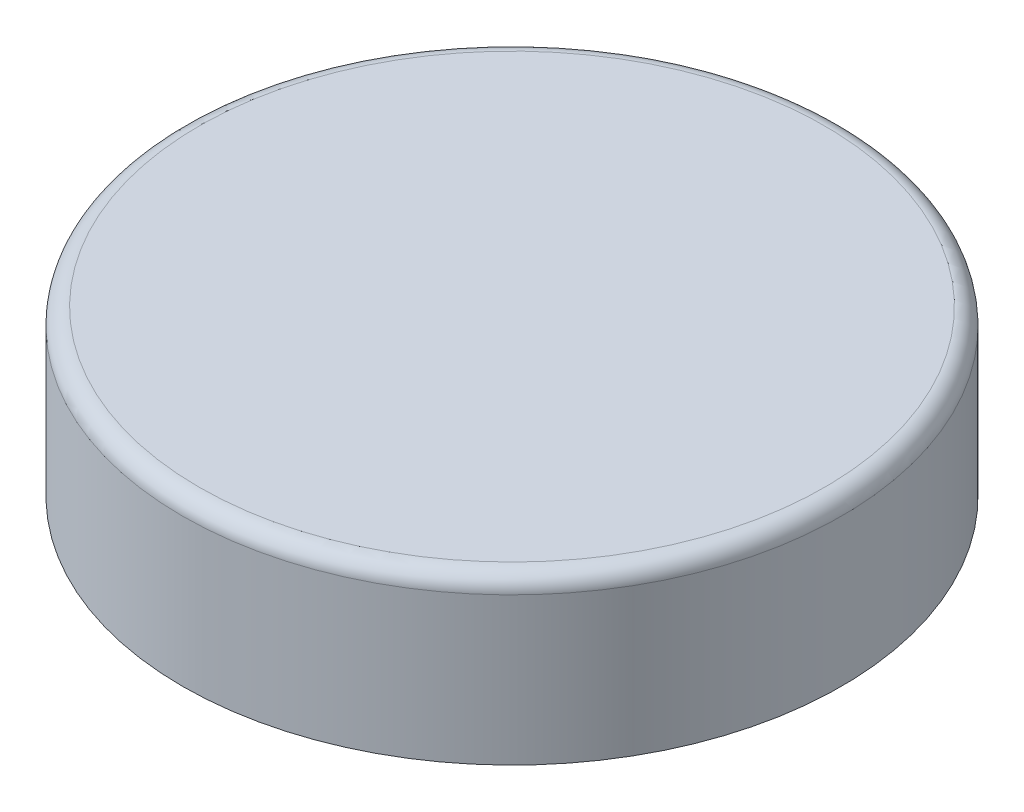
from build123d import *

# Parameters (mm, degrees)
SKETCH1_R           = 5.925
SKETCH1_R_2         = 4.625
BOSS_EXTRUDE1_DEPTH = 2.95
BOSS_EXTRUDE2_START = -0.4
SKETCH2_R           = 5.925
BOSS_EXTRUDE2_DEPTH = 0.4
FILLET1_R           = 0.3


with BuildPart() as part:
    # Sketch1 → Boss-Extrude1 (new body)
    with BuildSketch(Plane(origin=(0, 0, 0), x_dir=(1, 0, 0), z_dir=(0, 1, 0))):
        with Locations(Location((0, 0, 0), (0, 0, 270))):
            Circle(SKETCH1_R)
        with Locations(Location((0, 0, 0), (0, 0, 270))):
            Circle(SKETCH1_R_2, mode=Mode.SUBTRACT)
    extrude(amount=BOSS_EXTRUDE1_DEPTH)

    # Sketch2 → Boss-Extrude2 (add)
    with BuildSketch(Plane(origin=(0, 2.95, 0), x_dir=(1, 0, 0), z_dir=(0, 1, 0)).offset(BOSS_EXTRUDE2_START)):
        with Locations(Location((0, 0, 0), (0, 0, 270))):
            Circle(SKETCH2_R)
    extrude(amount=BOSS_EXTRUDE2_DEPTH)

    # Fillet1
    fillet1_edges = [part.edges().sort_by_distance(p)[0] for p in [
        (0, 2.95, -5.925),
    ]]
    fillet(fillet1_edges, radius=FILLET1_R)


solid = part.part
